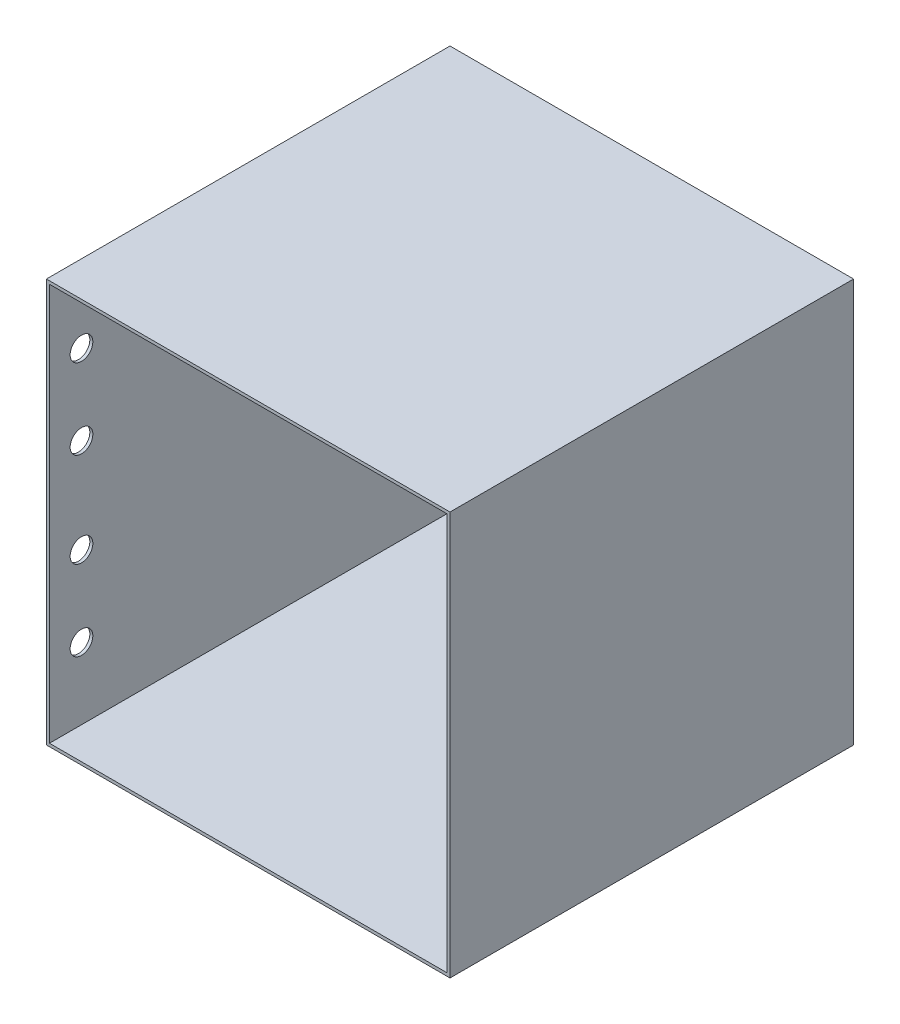
from build123d import *

# Parameters (mm, degrees)
CROQUIS1_W                        = 80
CROQUIS1_H                        = 80
SALIENTE_EXTRUIR1_DEPTH           = 80
VACIADO1_T                        = -0.6
TALADRO_DE_MARGEN_PARA_M41_REACH  = 179.383
TALADRO_DE_MARGEN_PARA_M41_BORE_R = 2.25


with BuildPart() as part:
    # Croquis1 → Saliente-Extruir1 (new body)
    with BuildSketch(Plane.XY):
        with Locations((40, 40)):
            Rectangle(CROQUIS1_W, CROQUIS1_H)
    extrude(amount=SALIENTE_EXTRUIR1_DEPTH)

    # Vaciado1
    vaciado1_openings = [part.faces().sort_by_distance(p)[0] for p in [
        (40, 40, 80),
        (40, 40, 0),
    ]]
    offset(amount=VACIADO1_T, openings=vaciado1_openings, kind=Kind.INTERSECTION)

    # Taladro de margen para M41 bore → Taladro de margen para M41 (cut, up to next)
    with BuildSketch(Plane(origin=(-1.000000915, -72.630862631, 39.906082067), x_dir=(0, 1, 0), z_dir=(-1, 0, 0)), mode=Mode.PRIVATE) as taladro_de_margen_para_m41_sk1:
        with Locations((87.393356175, -33.743917933)):
            Circle(TALADRO_DE_MARGEN_PARA_M41_BORE_R)
    taladro_de_margen_para_m41_tool1 = extrude(taladro_de_margen_para_m41_sk1.sketch, amount=-TALADRO_DE_MARGEN_PARA_M41_REACH, mode=Mode.PRIVATE) & part.part
    # Taladro de margen para M41 bore → Taladro de margen para M41 (cut, up to next)
    with BuildSketch(Plane(origin=(-1.000000915, -72.630862631, 39.906082067), x_dir=(0, 1, 0), z_dir=(-1, 0, 0)), mode=Mode.PRIVATE) as taladro_de_margen_para_m41_sk2:
        with Locations((103.268356175, -33.743917933)):
            Circle(TALADRO_DE_MARGEN_PARA_M41_BORE_R)
    taladro_de_margen_para_m41_tool2 = extrude(taladro_de_margen_para_m41_sk2.sketch, amount=-TALADRO_DE_MARGEN_PARA_M41_REACH, mode=Mode.PRIVATE) & part.part
    # Taladro de margen para M41 bore → Taladro de margen para M41 (cut, up to next)
    with BuildSketch(Plane(origin=(-1.000000915, -72.630862631, 39.906082067), x_dir=(0, 1, 0), z_dir=(-1, 0, 0)), mode=Mode.PRIVATE) as taladro_de_margen_para_m41_sk3:
        with Locations((121.993358005, -33.743917933)):
            Circle(TALADRO_DE_MARGEN_PARA_M41_BORE_R)
    taladro_de_margen_para_m41_tool3 = extrude(taladro_de_margen_para_m41_sk3.sketch, amount=-TALADRO_DE_MARGEN_PARA_M41_REACH, mode=Mode.PRIVATE) & part.part
    # Taladro de margen para M41 bore → Taladro de margen para M41 (cut, up to next)
    with BuildSketch(Plane(origin=(-1.000000915, -72.630862631, 39.906082067), x_dir=(0, 1, 0), z_dir=(-1, 0, 0)), mode=Mode.PRIVATE) as taladro_de_margen_para_m41_sk4:
        with Locations((137.868358005, -33.743917933)):
            Circle(TALADRO_DE_MARGEN_PARA_M41_BORE_R)
    taladro_de_margen_para_m41_tool4 = extrude(taladro_de_margen_para_m41_sk4.sketch, amount=-TALADRO_DE_MARGEN_PARA_M41_REACH, mode=Mode.PRIVATE) & part.part
    add(taladro_de_margen_para_m41_tool1.solids().sort_by_distance((-1.000001, 14.762494, 73.65))[0], mode=Mode.SUBTRACT)
    add(taladro_de_margen_para_m41_tool2.solids().sort_by_distance((-1.000001, 30.637494, 73.65))[0], mode=Mode.SUBTRACT)
    add(taladro_de_margen_para_m41_tool3.solids().sort_by_distance((-1.000001, 49.362495, 73.65))[0], mode=Mode.SUBTRACT)
    add(taladro_de_margen_para_m41_tool4.solids().sort_by_distance((-1.000001, 65.237495, 73.65))[0], mode=Mode.SUBTRACT)


solid = part.part
